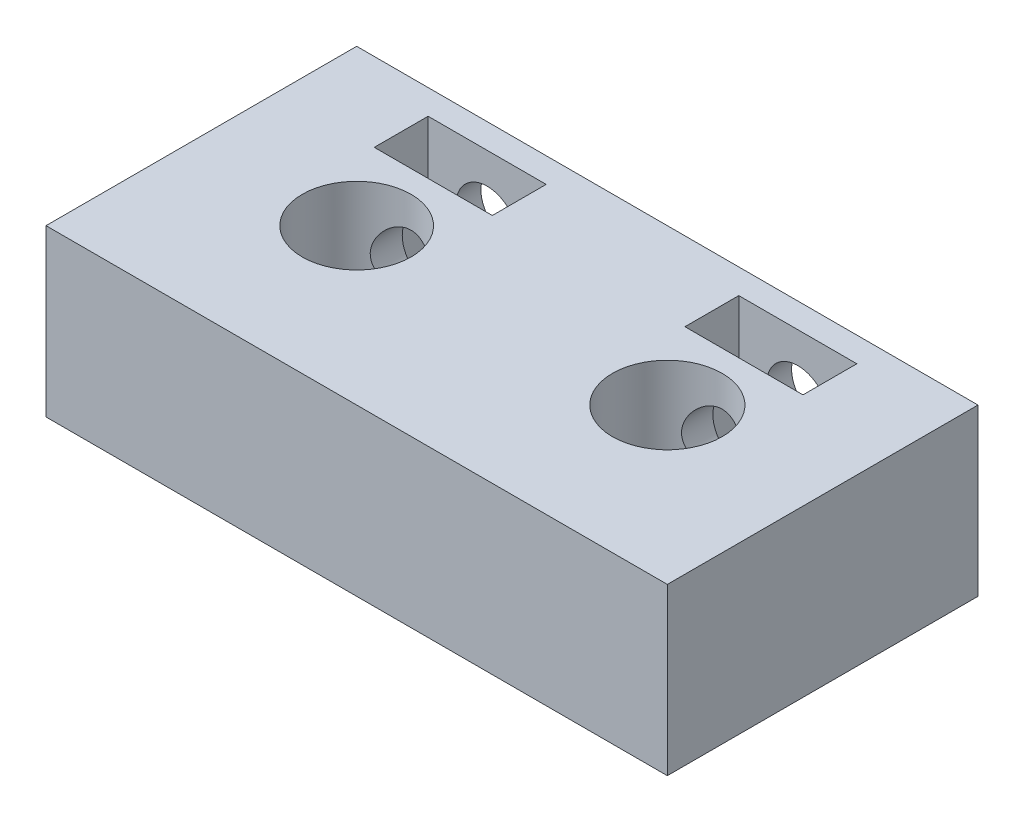
from build123d import *
from build123d.topology import SkipClean

# Parameters (mm, degrees)
SKETCH1_W           = 30
SKETCH1_H           = 15
SKETCH1_R           = 2.625
SKETCH1_R_2         = 2.65
SKETCH1_W_2         = 5.7
SKETCH1_H_2         = 2.6
BOSS_EXTRUDE1_DEPTH = 6
SKETCH3_R           = 1.5
CUT_EXTRUDE1_DEPTH  = 8
BOSS_EXTRUDE2_START = 2
SKETCH4_W           = 30
SKETCH4_H           = 15
SKETCH4_R           = 2.625
SKETCH4_R_2         = 2.65
BOSS_EXTRUDE2_DEPTH = 2


with BuildPart() as part:
    # Sketch1 → Boss-Extrude1 (new body)
    with BuildSketch(Plane(origin=(0, 0, 0), x_dir=(1, 0, 0), z_dir=(0, 1, 0))):
        Rectangle(SKETCH1_W, SKETCH1_H)
        with Locations(Location((-7.5, 0, 0), (0, 0, 270))):
            Circle(SKETCH1_R, mode=Mode.SUBTRACT)
        with Locations(Location((7.5, 0, 0), (0, 0, 270))):
            Circle(SKETCH1_R_2, mode=Mode.SUBTRACT)
        with Locations((-7.5, 5)):
            Rectangle(SKETCH1_W_2, SKETCH1_H_2, mode=Mode.SUBTRACT)
        with Locations((7.5, 5)):
            Rectangle(SKETCH1_W_2, SKETCH1_H_2, mode=Mode.SUBTRACT)
    extrude(amount=BOSS_EXTRUDE1_DEPTH)

    # Sketch3 → Cut-Extrude1 (cut)
    with BuildSketch(Plane(origin=(0, 0, -7.5), x_dir=(-1, 0, 0), z_dir=(0, 0, -1))):
        with Locations((7.5, 3)):
            Circle(SKETCH3_R)
        with Locations((-7.5, 3)):
            Circle(SKETCH3_R)
    extrude(amount=-CUT_EXTRUDE1_DEPTH, mode=Mode.SUBTRACT)

    # Sketch4 → Boss-Extrude2 (add)
    with SkipClean():  # the faces are left unmerged after this step: merging them gives an invalid solid
        with BuildSketch(Plane.XZ.offset(BOSS_EXTRUDE2_START)):
            Rectangle(SKETCH4_W, SKETCH4_H)
            with Locations(Location((-7.5, 0, 0), (0, 0, 270))):
                Circle(SKETCH4_R, mode=Mode.SUBTRACT)
            with Locations(Location((7.5, 0, 0), (0, 0, 270))):
                Circle(SKETCH4_R_2, mode=Mode.SUBTRACT)
        extrude(amount=-BOSS_EXTRUDE2_DEPTH)


solid = part.part
